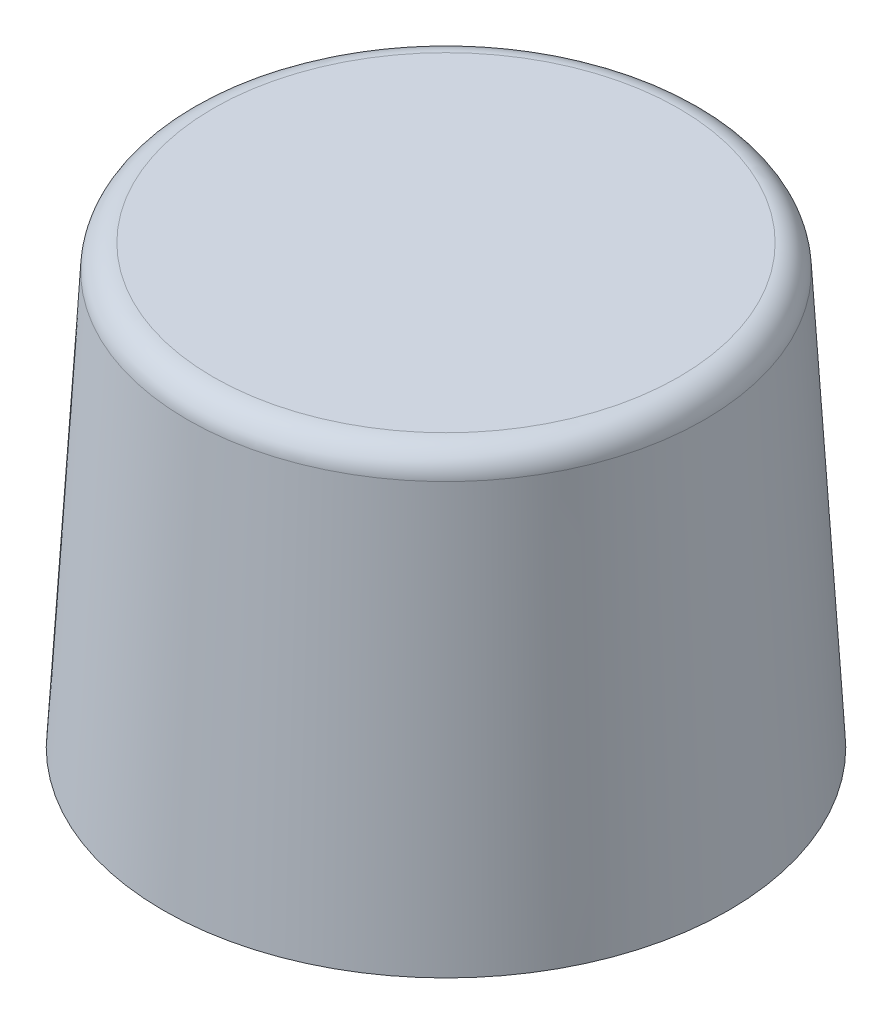
from build123d import *

# Parameters (mm, degrees)
SCHIZZO3_R               = 3
TAGLIO_ESTRUSIONE1_DEPTH = 15
RACCORDO1_R              = 1


with BuildPart() as part:
    # Schizzo2 → Rivoluzione1 (revolve)
    with BuildSketch(Plane.XY, mode=Mode.PRIVATE) as rivoluzione1_sk:
        Polygon((0, 0), (11, 0), (10, 17), (0, 17), align=None)
    revolve(rivoluzione1_sk.sketch.rotate(Axis((0, 17, 0), (0, -1, 0)), 180), axis=Axis((0, 17, 0), (0, -1, 0)))

    # Schizzo3 → Taglio-Estrusione1 (cut)
    with BuildSketch(Plane.XZ):
        Circle(SCHIZZO3_R)
    extrude(amount=-TAGLIO_ESTRUSIONE1_DEPTH, mode=Mode.SUBTRACT)

    # Raccordo1
    raccordo1_edges = [part.edges().sort_by_distance(p)[0] for p in [
        (10, 17, 0),
    ]]
    fillet(raccordo1_edges, radius=RACCORDO1_R)


solid = part.part
